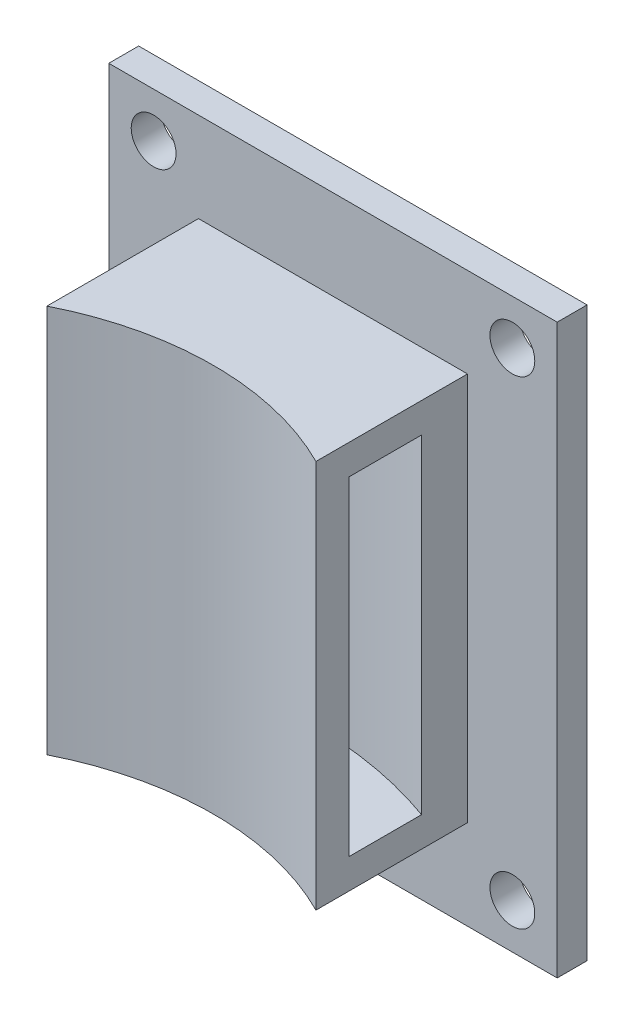
from build123d import *

# Parameters (mm, degrees)
EXTRUDE_1_DEPTH     = 11
EXTRUDE_1_2_DEPTH   = 11
EXTRUDE_2_DEPTH     = 2
SKETCH_5_W          = 30
SKETCH_5_H          = 38
SKETCH_5_W_2        = 18
SKETCH_5_H_2        = 26
EXTRUDE_3_DEPTH     = 2
SKETCH_6_R          = 1.5
CUT_EXTRUDE_1_DEPTH = 27.245152284


with BuildPart() as part:
    # 草图1 → 凸台-拉伸1 (new, symmetric)
    with BuildSketch(Plane(origin=(0, 0, 0), x_dir=(1, 0, 0), z_dir=(0, 1, 0))):
        with BuildLine():
            Line((-9, 30), (-9, 24.924887161))
            ThreePointArc((-9, 24.924887161), (0, 26.5), (9, 24.924887161))
            Line((9, 24.924887161), (9, 30))
            Line((9, 30), (-9, 30))
        make_face()
    extrude(amount=EXTRUDE_1_DEPTH, both=True)



with BuildPart() as body_2:
    # 草图1 → Extrude 1 2 (new, symmetric)
    with BuildSketch(Plane(origin=(0, 0, 0), x_dir=(1, 0, 0), z_dir=(0, 1, 0))):
        with BuildLine():
            Line((-9, 20.0748599), (-9, 17.860571099))
            ThreePointArc((-9, 17.860571099), (0, 20), (9, 17.860571099))
            Line((9, 17.860571099), (9, 20.0748599))
            ThreePointArc((9, 20.0748599), (0, 22), (-9, 20.0748599))
        make_face()
    extrude(amount=EXTRUDE_1_2_DEPTH, both=True)


with BuildPart() as part_1:
    add(part.part)

    add(body_2.part)  # 凸台-拉伸2 merges body 2
    # 草图2 → 凸台-拉伸2 (add)
    with BuildSketch(Plane(origin=(0, 11, 0), x_dir=(1, 0, 0), z_dir=(0, 1, 0))):
        with BuildLine():
            Line((-9, 30), (-9, 17.860571099))
            ThreePointArc((-9, 17.860571099), (0, 20), (9, 17.860571099))
            Line((9, 17.860571099), (9, 30))
            Line((9, 30), (-9, 30))
        make_face()
    extrude_2 = extrude(amount=EXTRUDE_2_DEPTH)

    # 镜向1: 凸台-拉伸2 across plane
    add(extrude_2.mirror(Plane.ZX))

    # 草图5 → 凸台-拉伸3 (add)
    with BuildSketch(Plane(origin=(0, 0, -30), x_dir=(-1, 0, 0), z_dir=(0, 0, -1))):
        Rectangle(SKETCH_5_W, SKETCH_5_H)
        Rectangle(SKETCH_5_W_2, SKETCH_5_H_2, mode=Mode.SUBTRACT)
    extrude(amount=-EXTRUDE_3_DEPTH)

    # 草图6 → 切除-拉伸1 (cut, through all)
    with BuildSketch(Plane.XY.offset(-28)):
        with Locations((12, 16)):
            Circle(SKETCH_6_R)
        with Locations(Location((-12, 16, 0), (0, 0, 180))):
            Circle(SKETCH_6_R)
        with Locations(Location((12, -16, 0), (0, 0, 180))):
            Circle(SKETCH_6_R)
        with Locations((-12, -16)):
            Circle(SKETCH_6_R)
    extrude(amount=-CUT_EXTRUDE_1_DEPTH, mode=Mode.SUBTRACT)


solid = part_1.part
